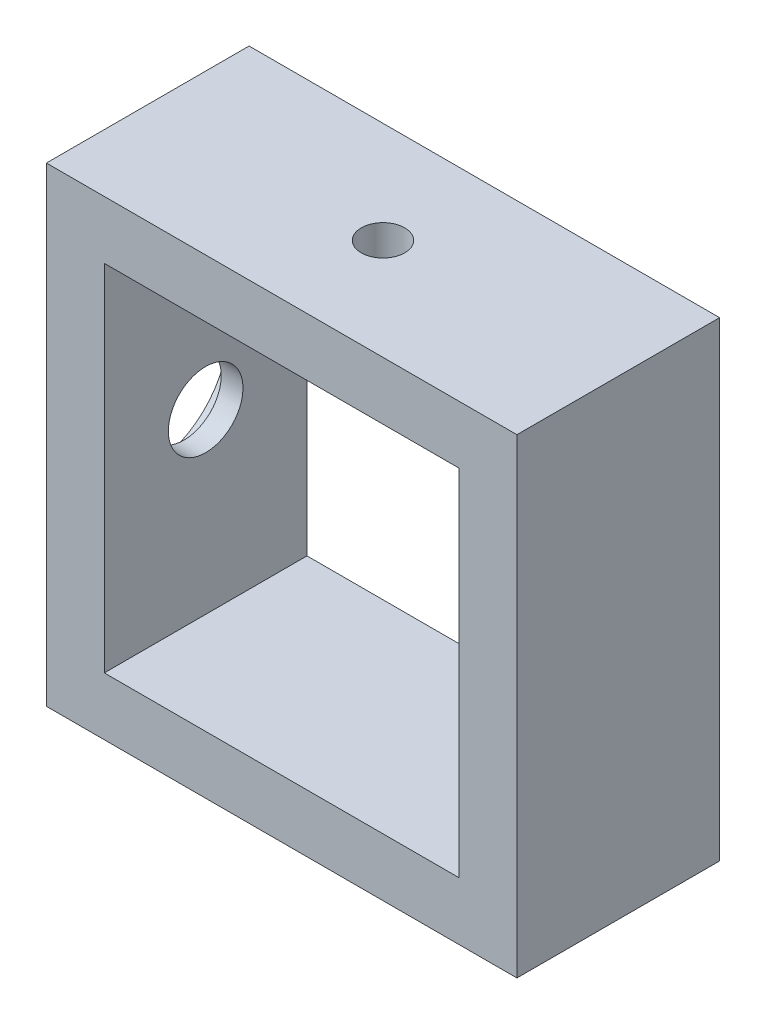
from build123d import *

# Parameters (mm, degrees)
CROQUIS1_W              = 65
CROQUIS1_H              = 65
CROQUIS1_W_2            = 49
CROQUIS1_H_2            = 49
SALIENTE_EXTRUIR1_DEPTH = 28
CROQUIS2_R              = 11.115
CORTAR_EXTRUIR1_DEPTH   = 5
CROQUIS3_R              = 5.155
CORTAR_EXTRUIR2_DEPTH   = 8
CROQUIS5_R              = 6.5
CORTAR_EXTRUIR3_DEPTH   = 5
CROQUIS6_R              = 3
CORTAR_EXTRUIR4_DEPTH   = 5
CROQUIS7_R              = 3.175
CORTAR_EXTRUIR5_DEPTH   = 5


with BuildPart() as part:
    # Croquis1 → Saliente-Extruir1 (new body)
    with BuildSketch(Plane.XY):
        with Locations((32.5, 32.5)):
            Rectangle(CROQUIS1_W, CROQUIS1_H)
        with Locations((32.5, 32.5)):
            Rectangle(CROQUIS1_W_2, CROQUIS1_H_2, mode=Mode.SUBTRACT)
    extrude(amount=SALIENTE_EXTRUIR1_DEPTH)

    # Croquis2 → Cortar-Extruir1 (cut)
    with BuildSketch(Plane.ZY):
        with Locations((14, 32.5)):
            Circle(CROQUIS2_R)
    extrude(amount=-CORTAR_EXTRUIR1_DEPTH, mode=Mode.SUBTRACT)

    # Croquis3 → Cortar-Extruir2 (cut)
    with BuildSketch(Plane.ZY):
        with Locations((14, 32.5)):
            Circle(CROQUIS3_R)
    extrude(amount=-CORTAR_EXTRUIR2_DEPTH, mode=Mode.SUBTRACT)

    # Croquis5 → Cortar-Extruir3 (cut)
    with BuildSketch(Plane.ZY.offset(-57)):
        with Locations((14, 32.5)):
            Circle(CROQUIS5_R)
    extrude(amount=-CORTAR_EXTRUIR3_DEPTH, mode=Mode.SUBTRACT)

    # Croquis6 → Cortar-Extruir4 (cut)
    with BuildSketch(Plane(origin=(0, 65, 0), x_dir=(1, 0, 0), z_dir=(0, 1, 0))):
        with Locations(Location((32.5, -14, 0), (0, 0, 270))):
            Circle(CROQUIS6_R)
    extrude(amount=-CORTAR_EXTRUIR4_DEPTH, mode=Mode.SUBTRACT)

    # Croquis7 → Cortar-Extruir5 (cut)
    with BuildSketch(Plane.XZ):
        with Locations(Location((32.5, 14, 0), (0, 0, 270))):
            Circle(CROQUIS7_R)
    extrude(amount=-CORTAR_EXTRUIR5_DEPTH, mode=Mode.SUBTRACT)


solid = part.part
